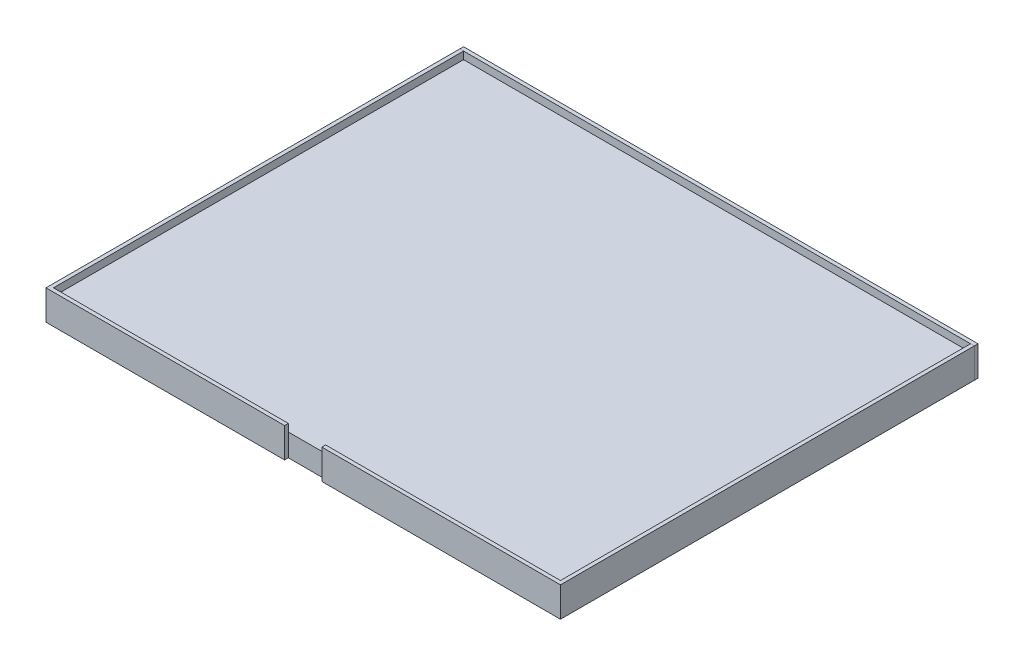
from build123d import *

# Parameters (mm, degrees)
SKETCH1_W           = 431.8
SKETCH1_H           = 349.25
BOSS_EXTRUDE1_DEPTH = 19.05
BOSS_EXTRUDE2_DEPTH = 25.4
SKETCH3_W           = 31.75
SKETCH3_H           = 25.4
CUT_EXTRUDE2_DEPTH  = 3.175
SKETCH4_W           = 438.15
SKETCH4_H           = 25.4
BOSS_EXTRUDE3_DEPTH = 3.175


with BuildPart() as part:
    # Sketch1 → Boss-Extrude1 (new body)
    with BuildSketch(Plane(origin=(0, 0, 0), x_dir=(1, 0, 0), z_dir=(0, 1, 0))):
        with Locations((215.9, 174.625)):
            Rectangle(SKETCH1_W, SKETCH1_H)
    extrude(amount=BOSS_EXTRUDE1_DEPTH)


with BuildPart() as body_2:
    # Sketch2 → Boss-Extrude2 (new body)
    with BuildSketch(Plane.XZ):
        Polygon((0, -349.25), (0, 0), (431.8, 0), (431.8, -349.25), (434.975, -349.25), (434.975, 3.175), (-3.175, 3.175), (-3.175, -349.25), align=None)
    extrude(amount=-BOSS_EXTRUDE2_DEPTH)

    # Sketch3 → Cut-Extrude2 (cut)
    with BuildSketch(Plane.XY.offset(3.175)):
        with Locations((215.9, 12.7)):
            Rectangle(SKETCH3_W, SKETCH3_H)
    extrude(amount=-CUT_EXTRUDE2_DEPTH, mode=Mode.SUBTRACT)


with BuildPart() as cut_extrude2_piece_1:
    # of the separate pieces the step leaves, piece 1, a body of its own (cut_extrude2_pieces)
    add(body_2.part.solids().sort_by_distance((231.775, 0, 0))[0])


with BuildPart() as cut_extrude2_piece_2:
    # of the separate pieces the step leaves, piece 2, a body of its own (cut_extrude2_pieces)
    add(body_2.part.solids().sort_by_distance((0, 0, -349.25))[0])


with BuildPart() as body_4:
    # Sketch4 → Boss-Extrude3 (new body)
    with BuildSketch(Plane(origin=(0, 0, -349.25), x_dir=(-1, 0, 0), z_dir=(0, 0, -1))):
        with Locations((-215.9, 12.7)):
            Rectangle(SKETCH4_W, SKETCH4_H)
    extrude(amount=BOSS_EXTRUDE3_DEPTH)


solid = Compound([part.part, cut_extrude2_piece_1.part, cut_extrude2_piece_2.part, body_4.part])
